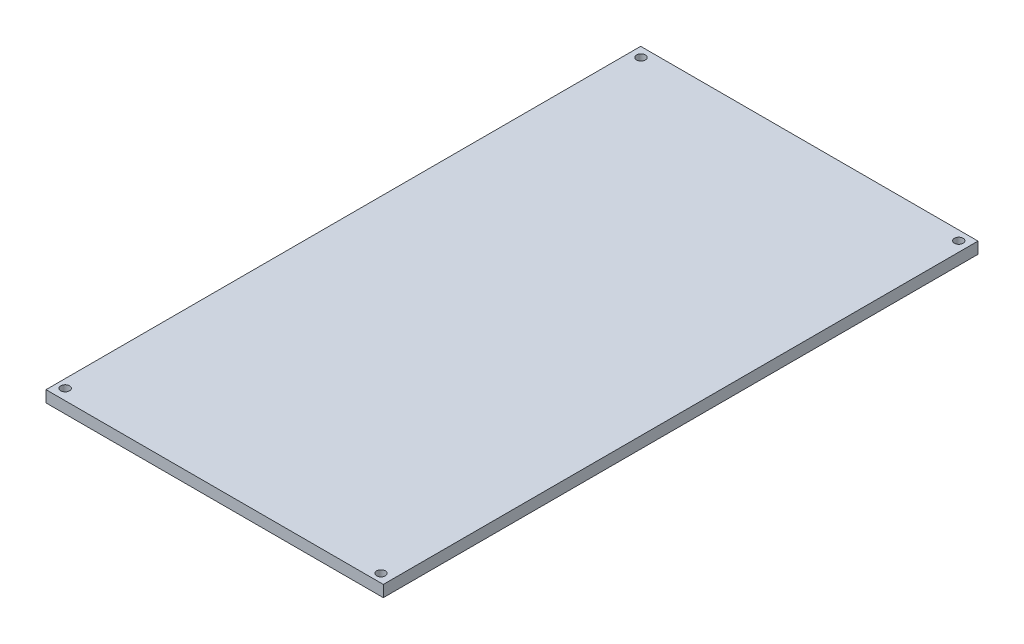
from build123d import *

# Parameters (mm, degrees)
SKETCH1_W           = 87.884
SKETCH1_H           = 154.94
SKETCH1_R           = 1.143
BOSS_EXTRUDE2_DEPTH = 3


with BuildPart() as part:
    # Sketch1 → Boss-Extrude2 (new body)
    with BuildSketch(Plane(origin=(0, 0, 0), x_dir=(1, 0, 0), z_dir=(0, 1, 0))):
        Rectangle(SKETCH1_W, SKETCH1_H)
        with Locations(Location((41.357244865, 75.027833565, 0), (0, 0, 270))):
            Circle(SKETCH1_R, mode=Mode.SUBTRACT)
        with Locations(Location((41.144556293, -75.274676629, 0), (0, 0, 270))):
            Circle(SKETCH1_R, mode=Mode.SUBTRACT)
        with Locations(Location((-41.750002777, -74.669949255, 0), (0, 0, 270))):
            Circle(SKETCH1_R, mode=Mode.SUBTRACT)
        with Locations(Location((-41.388534278, 74.995136609, 0), (0, 0, 270))):
            Circle(SKETCH1_R, mode=Mode.SUBTRACT)
    extrude(amount=BOSS_EXTRUDE2_DEPTH)


solid = part.part
